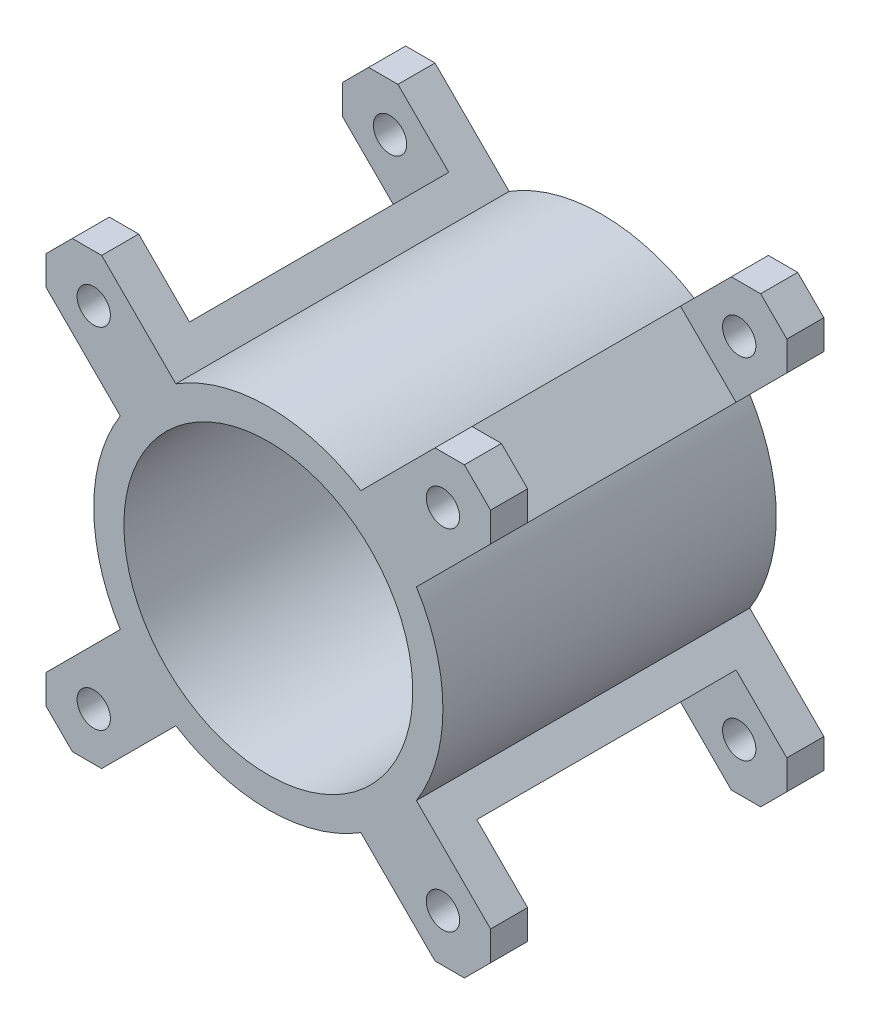
from build123d import *

# Parameters (mm, degrees)
SKETCH1_R           = 2.25
BOSS_EXTRUDE1_DEPTH = 45
CHAMFER1_SIZE       = 3.535533906
SKETCH2_W           = 35
SKETCH2_H           = 10.606601718
CUT_EXTRUDE1_DEPTH  = 12.5
CIRPATTERN1_COUNT   = 4


with BuildPart() as part:
    # Sketch1 → Boss-Extrude1 (new body)
    # profile 1 of 12: a face of its own
    with BuildSketch(Plane.XY):
        with BuildLine():
            Line((0, 60), (0, 52.5))
            Line((0, 52.5), (10.010851315, 42.489148685))
            ThreePointArc((10.010851315, 42.489148685), (13.333493167, 46.666506833), (17.510851315, 49.989148685))
            Line((17.510851315, 49.989148685), (7.5, 60))
            Line((7.5, 60), (0, 60))
        make_face()
        with Locations(Location((6.43, 53.57, 0), (0, 0, 180))):
            Circle(SKETCH1_R, mode=Mode.SUBTRACT)
    # profile 2 of 12: a face of its own
    with BuildSketch(Plane.XY):
        with BuildLine():
            ThreePointArc((17.510851315, 49.989148685), (13.333493167, 46.666506833), (10.010851315, 42.489148685))
            Line((10.010851315, 42.489148685), (12.98114549, 39.51885451))
            ThreePointArc((12.98114549, 39.51885451), (16.211417767, 43.788582233), (20.48114549, 47.01885451))
            Line((20.48114549, 47.01885451), (17.510851315, 49.989148685))
        make_face()
    # profile 3 of 12: a face of its own
    with BuildSketch(Plane.XY):
        with BuildLine():
            ThreePointArc((42.489148685, 49.989148685), (30, 53.57), (17.510851315, 49.989148685))
            Line((17.510851315, 49.989148685), (20.48114549, 47.01885451))
            ThreePointArc((20.48114549, 47.01885451), (30, 49.5), (39.51885451, 47.01885451))
            Line((39.51885451, 47.01885451), (42.489148685, 49.989148685))
        make_face()
    # profile 4 of 12: a face of its own
    with BuildSketch(Plane.XY):
        with BuildLine():
            ThreePointArc((49.989148685, 42.489148685), (46.666506833, 46.666506833), (42.489148685, 49.989148685))
            Line((42.489148685, 49.989148685), (39.51885451, 47.01885451))
            ThreePointArc((39.51885451, 47.01885451), (43.788582233, 43.788582233), (47.01885451, 39.51885451))
            Line((47.01885451, 39.51885451), (49.989148685, 42.489148685))
        make_face()
    # profile 5 of 12: a face of its own
    with BuildSketch(Plane.XY):
        with BuildLine():
            Line((49.989148685, 42.489148685), (60, 52.5))
            Line((60, 52.5), (60, 60))
            Line((60, 60), (52.5, 60))
            Line((52.5, 60), (42.489148685, 49.989148685))
            ThreePointArc((42.489148685, 49.989148685), (46.666506833, 46.666506833), (49.989148685, 42.489148685))
        make_face()
        with Locations(Location((53.57, 53.57, 0), (0, 0, 180))):
            Circle(SKETCH1_R, mode=Mode.SUBTRACT)
    # profile 6 of 12: a face of its own
    with BuildSketch(Plane.XY):
        with BuildLine():
            Line((47.01885451, 20.48114549), (49.989148685, 17.510851315))
            ThreePointArc((49.989148685, 17.510851315), (52.657108537, 23.503821681), (53.57, 30))
            ThreePointArc((53.57, 30), (52.657108537, 36.496178319), (49.989148685, 42.489148685))
            Line((49.989148685, 42.489148685), (47.01885451, 39.51885451))
            ThreePointArc((47.01885451, 39.51885451), (48.869521231, 34.918451843), (49.5, 30))
            ThreePointArc((49.5, 30), (48.869521231, 25.081548157), (47.01885451, 20.48114549))
        make_face()
    # profile 7 of 12: a face of its own
    with BuildSketch(Plane.XY):
        with BuildLine():
            Line((42.489148685, 10.010851315), (52.5, 0))
            Line((52.5, 0), (60, 0))
            Line((60, 0), (60, 7.5))
            Line((60, 7.5), (49.989148685, 17.510851315))
            ThreePointArc((49.989148685, 17.510851315), (46.666506833, 13.333493167), (42.489148685, 10.010851315))
        make_face()
        with Locations(Location((53.57, 6.43, 0), (0, 0, 180))):
            Circle(SKETCH1_R, mode=Mode.SUBTRACT)
    # profile 8 of 12: a face of its own
    with BuildSketch(Plane.XY):
        with BuildLine():
            Line((20.48114549, 12.98114549), (17.510851315, 10.010851315))
            ThreePointArc((17.510851315, 10.010851315), (30, 6.43), (42.489148685, 10.010851315))
            Line((42.489148685, 10.010851315), (39.51885451, 12.98114549))
            ThreePointArc((39.51885451, 12.98114549), (30, 10.5), (20.48114549, 12.98114549))
        make_face()
    # profile 9 of 12: a face of its own
    with BuildSketch(Plane.XY):
        with BuildLine():
            ThreePointArc((10.010851315, 17.510851315), (13.333493167, 13.333493167), (17.510851315, 10.010851315))
            Line((17.510851315, 10.010851315), (20.48114549, 12.98114549))
            ThreePointArc((20.48114549, 12.98114549), (16.211417767, 16.211417767), (12.98114549, 20.48114549))
            Line((12.98114549, 20.48114549), (10.010851315, 17.510851315))
        make_face()
    # profile 10 of 12: a face of its own
    with BuildSketch(Plane.XY):
        with BuildLine():
            Line((0, 7.5), (0, 0))
            Line((0, 0), (7.5, 0))
            Line((7.5, 0), (17.510851315, 10.010851315))
            ThreePointArc((17.510851315, 10.010851315), (13.333493167, 13.333493167), (10.010851315, 17.510851315))
            Line((10.010851315, 17.510851315), (0, 7.5))
        make_face()
        with Locations(Location((6.43, 6.43, 0), (0, 0, 180))):
            Circle(SKETCH1_R, mode=Mode.SUBTRACT)
    # profile 11 of 12: a face of its own
    with BuildSketch(Plane.XY):
        with BuildLine():
            Line((39.51885451, 12.98114549), (42.489148685, 10.010851315))
            ThreePointArc((42.489148685, 10.010851315), (46.666506833, 13.333493167), (49.989148685, 17.510851315))
            Line((49.989148685, 17.510851315), (47.01885451, 20.48114549))
            ThreePointArc((47.01885451, 20.48114549), (43.788582233, 16.211417767), (39.51885451, 12.98114549))
        make_face()
    # profile 12 of 12: a face of its own
    with BuildSketch(Plane.XY):
        with BuildLine():
            ThreePointArc((10.010851315, 42.489148685), (6.43, 30), (10.010851315, 17.510851315))
            Line((10.010851315, 17.510851315), (12.98114549, 20.48114549))
            ThreePointArc((12.98114549, 20.48114549), (10.5, 30), (12.98114549, 39.51885451))
            Line((12.98114549, 39.51885451), (10.010851315, 42.489148685))
        make_face()
    extrude(amount=BOSS_EXTRUDE1_DEPTH)

    # Chamfer1
    chamfer1_edges = [part.edges().sort_by_distance(p)[0] for p in [
        (0, 60, 22.5),
        (60, 60, 22.5),
        (60, 0, 22.5),
        (0, 0, 22.5),
    ]]
    chamfer(chamfer1_edges, length=CHAMFER1_SIZE)

    # Sketch2 → Cut-Extrude1 (cut)
    with BuildSketch(Plane(origin=(58.232233047, 58.232233047, 0), x_dir=(0, 0, -1), z_dir=(0.7071067811865489, 0.7071067811865461, 0))):
        with Locations((-22.5, 0)):
            Rectangle(SKETCH2_W, SKETCH2_H)
    cut_extrude1 = extrude(amount=-CUT_EXTRUDE1_DEPTH, mode=Mode.SUBTRACT)

    # CirPattern1: Cut-Extrude1 ×4 about axis
    cirpattern1_axis = Axis((30, 30, 0), (0, 0, 1))
    for i in range(1, CIRPATTERN1_COUNT):
        add(cut_extrude1.rotate(cirpattern1_axis, i * 360 / CIRPATTERN1_COUNT), mode=Mode.SUBTRACT)


solid = part.part
